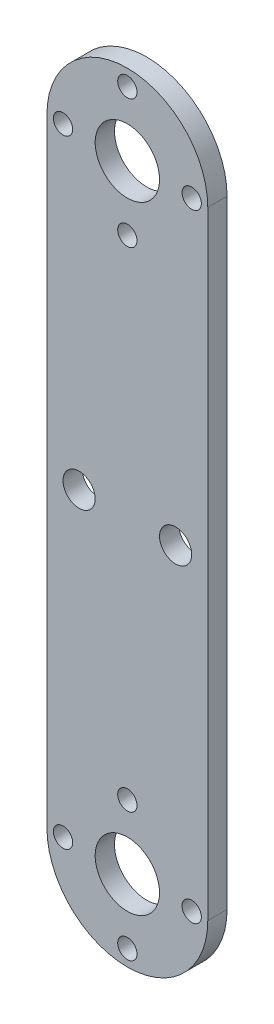
from build123d import *

# Parameters (mm, degrees)
SKETCH1_R           = 0.5
SKETCH1_R_2         = 0.25
BOSS_EXTRUDE2_DEPTH = 0.3
SKETCH2_R           = 0.15
CUT_EXTRUDE1_DEPTH  = 10
CIRPATTERN2_COUNT   = 4
SKETCH3_R           = 0.15
CUT_EXTRUDE2_DEPTH  = 10
CIRPATTERN3_COUNT   = 4


with BuildPart() as part:
    # Sketch1 → Boss-Extrude2 (new body)
    with BuildSketch(Plane.XY):
        with BuildLine():
            Line((0, 0), (0, 9.6))
            ThreePointArc((0, 9.6), (1.25, 10.85), (2.5, 9.6))
            Line((2.5, 9.6), (2.5, 0))
            ThreePointArc((2.5, 0), (1.25, -1.25), (0, 0))
        make_face()
        with Locations((1.25, 9.6)):
            Circle(SKETCH1_R, mode=Mode.SUBTRACT)
        with Locations((1.25, 0)):
            Circle(SKETCH1_R, mode=Mode.SUBTRACT)
        with Locations((0.5, 4.8)):
            Circle(SKETCH1_R_2, mode=Mode.SUBTRACT)
        with Locations((2, 4.8)):
            Circle(SKETCH1_R_2, mode=Mode.SUBTRACT)
    extrude(amount=BOSS_EXTRUDE2_DEPTH)

    # Sketch2 → Cut-Extrude1 (cut)
    with BuildSketch(Plane.XY.offset(0.3)):
        with Locations((0.25, 9.6)):
            Circle(SKETCH2_R)
    cut_extrude1 = extrude(amount=-CUT_EXTRUDE1_DEPTH, mode=Mode.SUBTRACT)

    # CirPattern2: Cut-Extrude1 ×4 about axis
    cirpattern2_axis = Axis((1.25, 9.6, 0), (0, 0, 1))
    for i in range(1, CIRPATTERN2_COUNT):
        add(cut_extrude1.rotate(cirpattern2_axis, i * 360 / CIRPATTERN2_COUNT), mode=Mode.SUBTRACT)

    # Sketch3 → Cut-Extrude2 (cut)
    with BuildSketch(Plane.XY.offset(0.3)):
        with Locations((2.25, 0)):
            Circle(SKETCH3_R)
    cut_extrude2 = extrude(amount=-CUT_EXTRUDE2_DEPTH, mode=Mode.SUBTRACT)

    # CirPattern3: Cut-Extrude2 ×4 about axis
    cirpattern3_axis = Axis((1.25, 0, 0), (0, 0, 1))
    for i in range(1, CIRPATTERN3_COUNT):
        add(cut_extrude2.rotate(cirpattern3_axis, i * 360 / CIRPATTERN3_COUNT), mode=Mode.SUBTRACT)


solid = part.part
